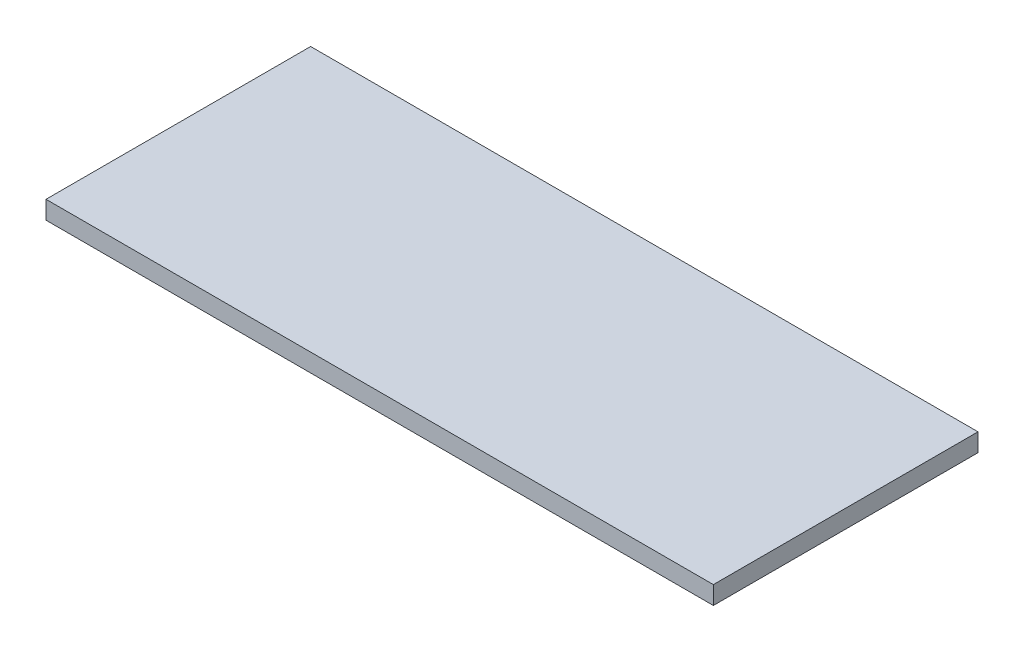
from build123d import *

# Parameters (mm, degrees)
SKETCH1_W           = 368.3
SKETCH1_H           = 146.05
BOSS_EXTRUDE1_DEPTH = 10


with BuildPart() as part:
    # Sketch1 → Boss-Extrude1 (new body)
    with BuildSketch(Plane(origin=(0, 0, 0), x_dir=(1, 0, 0), z_dir=(0, 1, 0))):
        with Locations((184.15, 73.025)):
            Rectangle(SKETCH1_W, SKETCH1_H)
    extrude(amount=BOSS_EXTRUDE1_DEPTH)


solid = part.part
